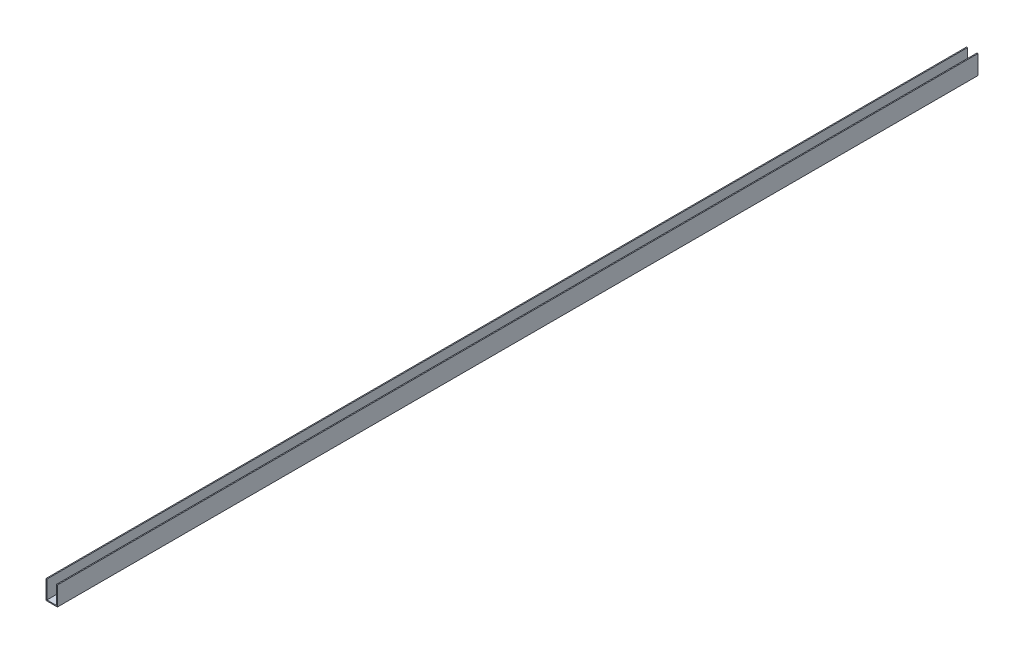
from build123d import *

# Parameters (mm, degrees)
EXTRUDE_1_DEPTH = 511


with BuildPart() as part:
    # 草图1 → 凸台-拉伸1 (new body)
    with BuildSketch(Plane.XY):
        Polygon((-2.61, 5.025), (-3.16, 5.025), (-3.16, -5.575), (3.16, -5.575), (3.16, 5.025), (2.61, 5.025), (2.61, -5.025), (-2.61, -5.025), align=None)
    extrude(amount=EXTRUDE_1_DEPTH)


solid = part.part
